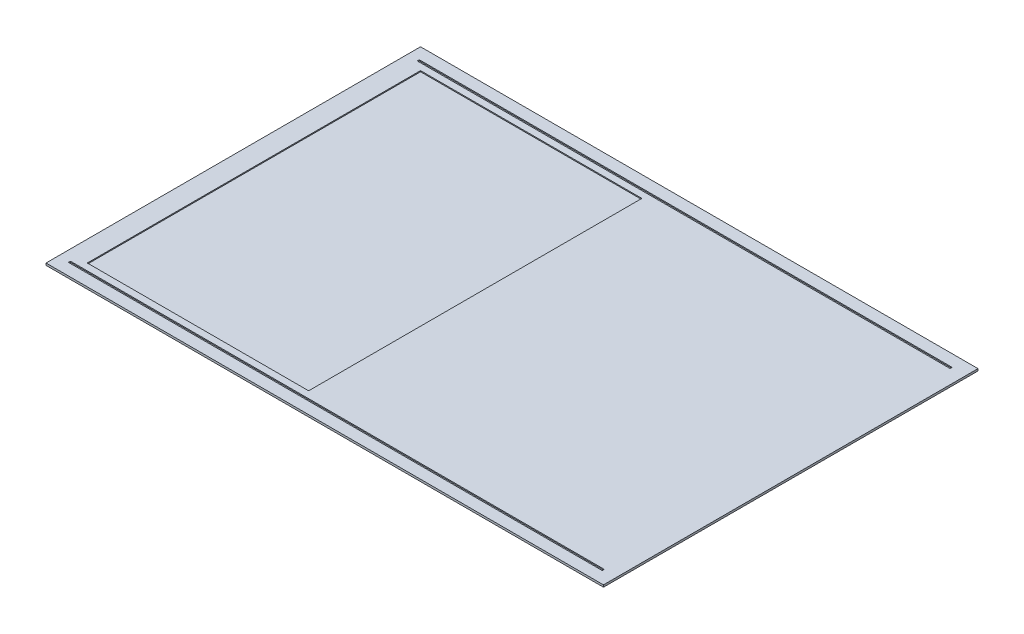
from build123d import *

# Parameters (mm, degrees)
SKETCH1_W           = 5400
SKETCH1_H           = 3628
SKETCH1_W_2         = 2144.1
SKETCH1_H_2         = 3228
BOSS_EXTRUDE1_DEPTH = 20
SKETCH4_W           = 2144.1
SKETCH4_H           = 3228
BOSS_EXTRUDE2_DEPTH = 10
CUT_EXTRUDE1_DEPTH  = 10


with BuildPart() as part:
    # Sketch1 → Boss-Extrude1 (new body)
    with BuildSketch(Plane(origin=(0, 0, 0), x_dir=(1, 0, 0), z_dir=(0, 1, 0))):
        with Locations((-103.776435045, -2408.652567976)):
            Rectangle(SKETCH1_W, SKETCH1_H)
        with Locations((-1531.726435045, -2408.652567976)):
            Rectangle(SKETCH1_W_2, SKETCH1_H_2, mode=Mode.SUBTRACT)
    extrude(amount=BOSS_EXTRUDE1_DEPTH)

    # Sketch4 → Boss-Extrude2 (add)
    with BuildSketch(Plane(origin=(0, 0, 0), x_dir=(1, 0, 0), z_dir=(0, 1, 0))):
        with Locations((-1531.726435045, -2408.652567976)):
            Rectangle(SKETCH4_W, SKETCH4_H)
    extrude(amount=BOSS_EXTRUDE2_DEPTH)

    # Sketch5 → Cut-Extrude1 (cut)
    with BuildSketch(Plane(origin=(0, 20, 0), x_dir=(1, 0, 0), z_dir=(0, 1, 0))):
        Polygon((-2700.132260169, -718.652567976), (-2700.132260169, -729.245671205), (2460.618113796, -729.245671205), (2460.618113796, -709.245671205), (-2700.132260169, -709.245671205), align=None)
        Polygon((-2700.132260169, -4098.652567976), (-2700.132260169, -4108.652567976), (2470.664759236, -4108.652567976), (2470.664759236, -4088.652567976), (-2700.132260169, -4088.652567976), align=None)
    extrude(amount=-CUT_EXTRUDE1_DEPTH, mode=Mode.SUBTRACT)


solid = part.part
